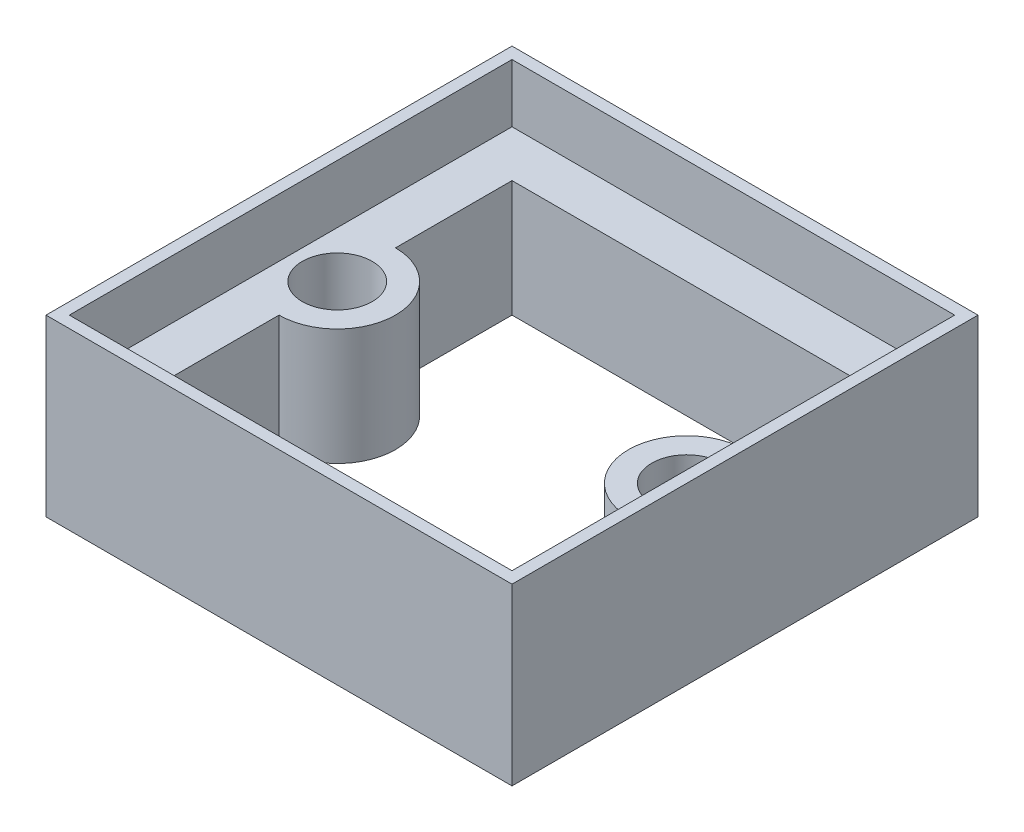
from build123d import *

# Parameters (mm, degrees)
SKETCH1_W           = 40
SKETCH1_H           = 40
SKETCH1_R           = 3
BOSS_EXTRUDE2_DEPTH = 10
BOSS_EXTRUDE3_DEPTH = 10
SKETCH1_5_R         = 3
SKETCH1_5_R_2       = 1.5
BOSS_EXTRUDE4_DEPTH = 2
SKETCH2_W           = 40
SKETCH2_H           = 40
SKETCH2_W_2         = 38
SKETCH2_H_2         = 38
BOSS_EXTRUDE5_DEPTH = 5


with BuildPart() as part:
    # Sketch1 → Boss-Extrude2 (new body)
    with BuildSketch(Plane(origin=(0, 0, 0), x_dir=(1, 0, 0), z_dir=(0, 1, 0))):
        Rectangle(SKETCH1_W, SKETCH1_H)
        with BuildLine():
            Line((-15, 3), (-15, 15))
            Line((-15, 15), (15, 15))
            Line((15, 15), (15, 5))
            ThreePointArc((15, 5), (10, 0), (15, -5))
            Line((15, -5), (15, -15))
            Line((15, -15), (-15, -15))
            Line((-15, -15), (-15, -3))
            ThreePointArc((-15, -3), (-18, 0), (-15, 3))
        make_face(mode=Mode.SUBTRACT)
        with Locations((15, 0)):
            Circle(SKETCH1_R, mode=Mode.SUBTRACT)
    extrude(amount=BOSS_EXTRUDE2_DEPTH)

    # Sketch1<4> → Boss-Extrude3 (add)
    with BuildSketch(Plane(origin=(0, 0, 0), x_dir=(1, 0, 0), z_dir=(0, 1, 0))):
        with BuildLine():
            ThreePointArc((-10, 0), (-11.464466094, 3.535533906), (-15, 5))
            Line((-15, 5), (-15, 3))
            ThreePointArc((-15, 3), (-12.878679656, 2.121320344), (-12, 0))
            ThreePointArc((-12, 0), (-12.878679656, -2.121320344), (-15, -3))
            Line((-15, -3), (-15, -5))
            ThreePointArc((-15, -5), (-11.464466094, -3.535533906), (-10, 0))
        make_face()
    extrude(amount=BOSS_EXTRUDE3_DEPTH)

    # Sketch1<5> → Boss-Extrude4 (add)
    # profile 1 of 2: a face of its own
    with BuildSketch(Plane(origin=(0, 0, 0), x_dir=(1, 0, 0), z_dir=(0, 1, 0))):
        with Locations((-15, 0)):
            Circle(SKETCH1_5_R)
        with Locations((-15, 0)):
            Circle(SKETCH1_5_R_2, mode=Mode.SUBTRACT)
    # profile 2 of 2: a face of its own
    with BuildSketch(Plane(origin=(0, 0, 0), x_dir=(1, 0, 0), z_dir=(0, 1, 0))):
        with Locations((15, 0)):
            Circle(SKETCH1_5_R)
        with Locations((15, 0)):
            Circle(SKETCH1_5_R_2, mode=Mode.SUBTRACT)
    extrude(amount=BOSS_EXTRUDE4_DEPTH)

    # Sketch2 → Boss-Extrude5 (add)
    with BuildSketch(Plane(origin=(0, 10, 0), x_dir=(1, 0, 0), z_dir=(0, 1, 0))):
        Rectangle(SKETCH2_W, SKETCH2_H)
        Rectangle(SKETCH2_W_2, SKETCH2_H_2, mode=Mode.SUBTRACT)
    extrude(amount=BOSS_EXTRUDE5_DEPTH)


solid = part.part
